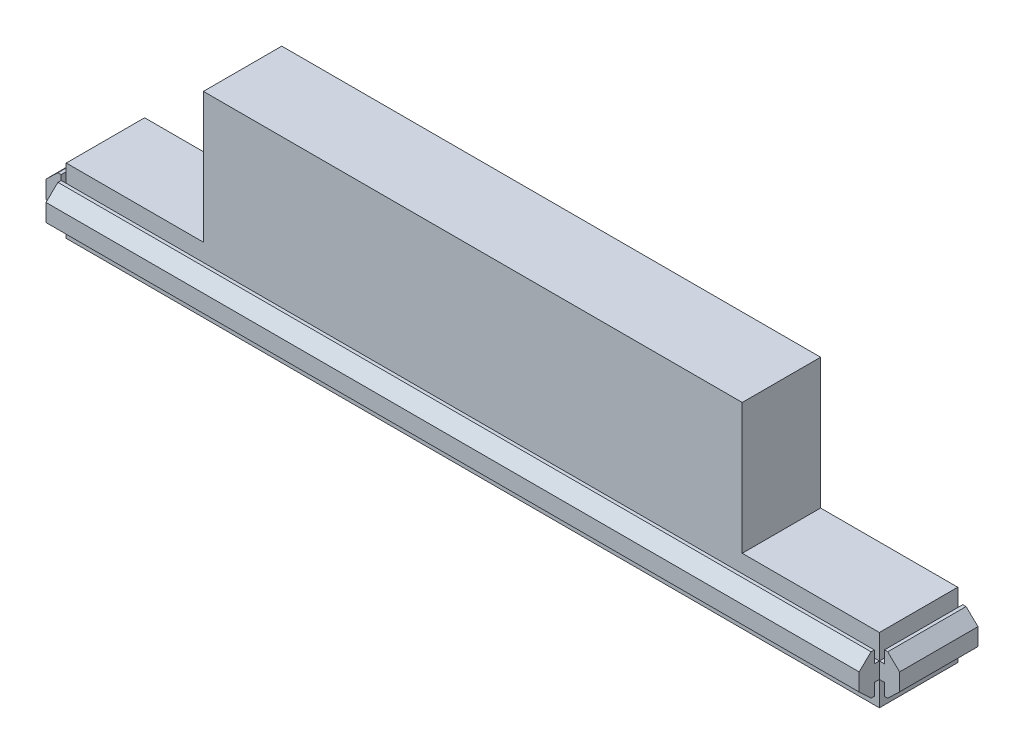
from build123d import *

# Parameters (mm, degrees)
ESQUISSE1_W                   = 261.4
ESQUISSE1_H                   = 50
BOSS_EXTRU_1_DEPTH            = 30.2
ENL_V_MAT_EXTRU_3_DEPTH       = 268.846971235
ENL_V_MAT_EXTRU_3_DEPTH_BACK  = 6.2
ENL_V_MAT_EXTRU_4_DEPTH       = 268.846971235
ENL_V_MAT_EXTRU_4_DEPTH_BACK  = 6.2
ENL_V_MAT_EXTRU_6_DEPTH       = 268.846971235
ENL_V_MAT_EXTRU_6_DEPTH_BACK  = 6.2
ENL_V_MAT_EXTRU_7_DEPTH       = 262.799694423
ENL_V_MAT_EXTRU_7_DEPTH_BACK  = 249
ENL_V_MAT_EXTRU_9_DEPTH       = 262.799694423
ENL_V_MAT_EXTRU_9_DEPTH_BACK  = 249
ENL_V_MAT_EXTRU_11_DEPTH      = 268.846971235
ENL_V_MAT_EXTRU_11_DEPTH_BACK = 24
ENL_V_MAT_EXTRU_12_DEPTH      = 268.846971235
ENL_V_MAT_EXTRU_12_DEPTH_BACK = 24
ENL_V_MAT_EXTRU_13_DEPTH      = 268.218936455
ENL_V_MAT_EXTRU_13_DEPTH_BACK = 24
ENL_V_MAT_EXTRU_14_DEPTH      = 268.218936455
ENL_V_MAT_EXTRU_14_DEPTH_BACK = 24
ENL_V_MAT_EXTRU_15_DEPTH      = 268.218936455
ENL_V_MAT_EXTRU_15_DEPTH_BACK = 24
ENL_V_MAT_EXTRU_16_DEPTH      = 268.218936455
ENL_V_MAT_EXTRU_16_DEPTH_BACK = 24
ESQUISSE22_W                  = 220
ESQUISSE22_H                  = 24
BOSS_EXTRU_2_DEPTH            = 10
ESQUISSE23_W                  = 15
ESQUISSE23_H                  = 40
ENL_V_MAT_EXTRU_18_DEPTH      = 24
ESQUISSE24_W                  = 12.5
ESQUISSE24_H                  = 40
ENL_V_MAT_EXTRU_24_DEPTH      = 30
ENL_V_MAT_EXTRU_25_DEPTH      = 270.89257122
ENL_V_MAT_EXTRU_25_DEPTH_BACK = 30
ESQUISSE33_W                  = 30
ESQUISSE33_H                  = 30
ENL_V_MAT_EXTRU_26_DEPTH      = 20
ESQUISSE34_R                  = 2
BOSS_EXTRU_6_DEPTH            = 30
ESQUISSE35_W                  = 30
ESQUISSE35_H                  = 30
ENL_V_MAT_EXTRU_27_DEPTH      = 20
ESQUISSE36_R                  = 2
BOSS_EXTRU_7_DEPTH            = 30


with BuildPart() as part:
    # Esquisse1 → Boss.-Extru.1 (new body)
    with BuildSketch(Plane.XY):
        with Locations((130.7, 25)):
            Rectangle(ESQUISSE1_W, ESQUISSE1_H)
    extrude(amount=BOSS_EXTRU_1_DEPTH)

    # Esquisse2 → Enlèv. mat.-Extru.3 (cut, two sides: drawn at the far end of the back side and taken through both)
    with BuildSketch(Plane.XY.offset(30.2).offset(-ENL_V_MAT_EXTRU_3_DEPTH_BACK)):
        Polygon((797.631736025, 20), (261.4, 20), (0, 20), (-536.231736025, 20), (-536.231736025, 1092.46347205), (797.631736025, 1092.46347205), align=None)
    extrude(amount=ENL_V_MAT_EXTRU_3_DEPTH + ENL_V_MAT_EXTRU_3_DEPTH_BACK, mode=Mode.SUBTRACT)

    # Esquisse5 → Enlèv. mat.-Extru.4 (cut, two sides: drawn at the far end of the back side and taken through both)
    with BuildSketch(Plane.XY.offset(30.2).offset(-ENL_V_MAT_EXTRU_4_DEPTH_BACK)):
        Polygon((6.2, -530.103989602), (6.2, 0), (6.2, 20), (6.2, 550.103989602), (-1054.007979204, 550.103989602), (-1054.007979204, -530.103989602), align=None)
    extrude(amount=ENL_V_MAT_EXTRU_4_DEPTH + ENL_V_MAT_EXTRU_4_DEPTH_BACK, mode=Mode.SUBTRACT)

    # Esquisse6 → Enlèv. mat.-Extru.6 (cut, two sides: drawn at the far end of the back side and taken through both)
    with BuildSketch(Plane.XY.offset(30.2).offset(-ENL_V_MAT_EXTRU_6_DEPTH_BACK)):
        Polygon((255.2, 550.103989602), (255.2, 20), (255.2, 0), (255.2, -530.103989602), (1315.407979204, -530.103989602), (1315.407979204, 550.103989602), align=None)
    extrude(amount=ENL_V_MAT_EXTRU_6_DEPTH + ENL_V_MAT_EXTRU_6_DEPTH_BACK, mode=Mode.SUBTRACT)

    # Esquisse8 → Enlèv. mat.-Extru.7 (cut, two sides: drawn at the far end of the back side and taken through both)
    with BuildSketch(Plane(origin=(255.2, 0, 0), x_dir=(0, 0, -1), z_dir=(1, 0, 0)).offset(-ENL_V_MAT_EXTRU_7_DEPTH_BACK)):
        Polygon((-24, -120.923396991), (-24, 0), (-24, 7.55), (-25.55, 7.55), (-25.55, 3.85), (-26.504639672, 3.85), (-30.2, 7.30657519), (-118.511368381, 89.911479128), (-339.199142385, -9.016667344), (-244.687774004, -219.851543463), align=None)
    extrude(amount=ENL_V_MAT_EXTRU_7_DEPTH + ENL_V_MAT_EXTRU_7_DEPTH_BACK, mode=Mode.SUBTRACT)

    # Esquisse9 → Enlèv. mat.-Extru.9 (cut, two sides: drawn at the far end of the back side and taken through both)
    with BuildSketch(Plane(origin=(255.2, 0, 0), x_dir=(0, 0, -1), z_dir=(1, 0, 0)).offset(-ENL_V_MAT_EXTRU_9_DEPTH_BACK)):
        Polygon((-24, 126.070686284), (-24, 20), (-24, 12.45), (-25.55, 12.45), (-25.55, 16.15), (-26.55, 16.15), (-30.2, 12.645559959), (-106.713439711, -60.816566558), (-300.704336754, 25.040837428), (-217.990897044, 211.92809027), align=None)
    extrude(amount=ENL_V_MAT_EXTRU_9_DEPTH + ENL_V_MAT_EXTRU_9_DEPTH_BACK, mode=Mode.SUBTRACT)

    # Esquisse10 → Enlèv. mat.-Extru.11 (cut, two sides: drawn at the far end of the back side and taken through both)
    with BuildSketch(Plane(origin=(0, 0, 0), x_dir=(-1, 0, 0), z_dir=(0, 0, -1)).offset(-ENL_V_MAT_EXTRU_11_DEPTH_BACK)):
        Polygon((536.231736025, 20), (0, 20), (-20.7, 20), (-20.7, 50), (-20.7, 586.231736025), (743.899228974, 1338.272903737), (1300.830964999, 772.041167712), align=None)
    extrude(amount=ENL_V_MAT_EXTRU_11_DEPTH + ENL_V_MAT_EXTRU_11_DEPTH_BACK, mode=Mode.SUBTRACT)

    # Esquisse11 → Enlèv. mat.-Extru.12 (cut, two sides: drawn at the far end of the back side and taken through both)
    with BuildSketch(Plane(origin=(0, 0, 0), x_dir=(-1, 0, 0), z_dir=(0, 0, -1)).offset(-ENL_V_MAT_EXTRU_12_DEPTH_BACK)):
        Polygon((-797.631736025, 20), (-261.4, 20), (-240.7, 20), (-240.7, 50), (-240.7, 586.231736025), (-1005.299228974, 1338.272903737), (-1562.230964999, 772.041167712), align=None)
    extrude(amount=ENL_V_MAT_EXTRU_12_DEPTH + ENL_V_MAT_EXTRU_12_DEPTH_BACK, mode=Mode.SUBTRACT)

    # Esquisse12 → Enlèv. mat.-Extru.13 (cut, two sides: drawn at the far end of the back side and taken through both)
    with BuildSketch(Plane.XY.offset(24).offset(-ENL_V_MAT_EXTRU_13_DEPTH_BACK)):
        Polygon((6.2, 0), (6.2, 7.55), (4.65, 7.55), (4.65, 3.85), (3.65, 3.85), (0, 7.354440041), (0, 0), align=None)
    extrude(amount=ENL_V_MAT_EXTRU_13_DEPTH + ENL_V_MAT_EXTRU_13_DEPTH_BACK, mode=Mode.SUBTRACT)

    # Esquisse13 → Enlèv. mat.-Extru.14 (cut, two sides: drawn at the far end of the back side and taken through both)
    with BuildSketch(Plane.XY.offset(24).offset(-ENL_V_MAT_EXTRU_14_DEPTH_BACK)):
        Polygon((-388.163092547, -360.037805495), (0, 12.645559959), (3.65, 16.15), (4.65, 16.15), (4.65, 12.45), (6.2, 12.45), (6.2, 20), (6.2, 558.111026928), (-982.664286619, 982.847806423), (-1377.027379166, 64.698974), align=None)
    extrude(amount=ENL_V_MAT_EXTRU_14_DEPTH + ENL_V_MAT_EXTRU_14_DEPTH_BACK, mode=Mode.SUBTRACT)

    # Esquisse16 → Enlèv. mat.-Extru.15 (cut, two sides: drawn at the far end of the back side and taken through both)
    with BuildSketch(Plane.XY.offset(24).offset(-ENL_V_MAT_EXTRU_15_DEPTH_BACK)):
        Polygon((255.2, 20), (255.2, 12.45), (256.75, 12.45), (256.75, 16.15), (257.75, 16.15), (261.4, 12.645559959), (261.4, 20), align=None)
    extrude(amount=ENL_V_MAT_EXTRU_15_DEPTH + ENL_V_MAT_EXTRU_15_DEPTH_BACK, mode=Mode.SUBTRACT)

    # Esquisse17 → Enlèv. mat.-Extru.16 (cut, two sides: drawn at the far end of the back side and taken through both)
    with BuildSketch(Plane.XY.offset(24).offset(-ENL_V_MAT_EXTRU_16_DEPTH_BACK)):
        Polygon((650.717680613, 381.146349234), (261.4, 7.354440041), (257.75, 3.85), (256.75, 3.85), (256.75, 7.55), (255.2, 7.55), (255.2, 0), (255.2, -539.711633945), (1247.009188557, -965.703564334), (1642.52686917, -44.845581155), align=None)
    extrude(amount=ENL_V_MAT_EXTRU_16_DEPTH + ENL_V_MAT_EXTRU_16_DEPTH_BACK, mode=Mode.SUBTRACT)

    # Esquisse22 → Boss.-Extru.2 (add)
    with BuildSketch(Plane(origin=(0, 50, 0), x_dir=(1, 0, 0), z_dir=(0, 1, 0))):
        with Locations((130.7, -12)):
            Rectangle(ESQUISSE22_W, ESQUISSE22_H)
    extrude(amount=BOSS_EXTRU_2_DEPTH)

    # Esquisse23 → Enlèv. mat.-Extru.18 (cut)
    with BuildSketch(Plane(origin=(0, 0, 0), x_dir=(-1, 0, 0), z_dir=(0, 0, -1))):
        with Locations((-233.2, 40)):
            Rectangle(ESQUISSE23_W, ESQUISSE23_H)
    extrude(amount=-ENL_V_MAT_EXTRU_18_DEPTH, mode=Mode.SUBTRACT)

    # Esquisse24 → Enlèv. mat.-Extru.24 (cut)
    with BuildSketch(Plane(origin=(0, 0, 0), x_dir=(-1, 0, 0), z_dir=(0, 0, -1))):
        with Locations((-219.45, 40)):
            Rectangle(ESQUISSE24_W, ESQUISSE24_H)
    extrude(amount=-ENL_V_MAT_EXTRU_24_DEPTH, mode=Mode.SUBTRACT)

    # Esquisse32 → Enlèv. mat.-Extru.25 (cut, two sides: drawn at the far end of the back side and taken through both)
    with BuildSketch(Plane(origin=(0, 0, 0), x_dir=(-1, 0, 0), z_dir=(0, 0, -1)).offset(-ENL_V_MAT_EXTRU_25_DEPTH_BACK)):
        Polygon((477.302008193, 20), (-20.7, 20), (-48.2, 20), (-48.2, 60), (-48.2, 558.002008193), (664.309819102, 1253.957292919), (1189.811827295, 715.955284726), align=None)
    extrude(amount=ENL_V_MAT_EXTRU_25_DEPTH + ENL_V_MAT_EXTRU_25_DEPTH_BACK, mode=Mode.SUBTRACT)

    # Esquisse33 → Enlèv. mat.-Extru.26 (cut)
    with BuildSketch(Plane(origin=(0, 0, 0), x_dir=(-1, 0, 0), z_dir=(0, 0, -1))):
        with Locations((-193.2, 40)):
            Rectangle(ESQUISSE33_W, ESQUISSE33_H)
    extrude(amount=-ENL_V_MAT_EXTRU_26_DEPTH, mode=Mode.SUBTRACT)

    # Esquisse34 → Boss.-Extru.6 (add)
    with BuildSketch(Plane(origin=(0, 0, 20), x_dir=(-1, 0, 0), z_dir=(0, 0, -1))):
        with Locations((-193.2, 40)):
            Circle(ESQUISSE34_R)
    extrude(amount=BOSS_EXTRU_6_DEPTH)

    # Esquisse35 → Enlèv. mat.-Extru.27 (cut)
    with BuildSketch(Plane(origin=(0, 0, 0), x_dir=(-1, 0, 0), z_dir=(0, 0, -1))):
        with Locations((-68.2, 40)):
            Rectangle(ESQUISSE35_W, ESQUISSE35_H)
    extrude(amount=-ENL_V_MAT_EXTRU_27_DEPTH, mode=Mode.SUBTRACT)

    # Esquisse36 → Boss.-Extru.7 (add)
    with BuildSketch(Plane(origin=(0, 0, 20), x_dir=(-1, 0, 0), z_dir=(0, 0, -1))):
        with Locations((-68.2, 40)):
            Circle(ESQUISSE36_R)
    extrude(amount=BOSS_EXTRU_7_DEPTH)


solid = part.part
